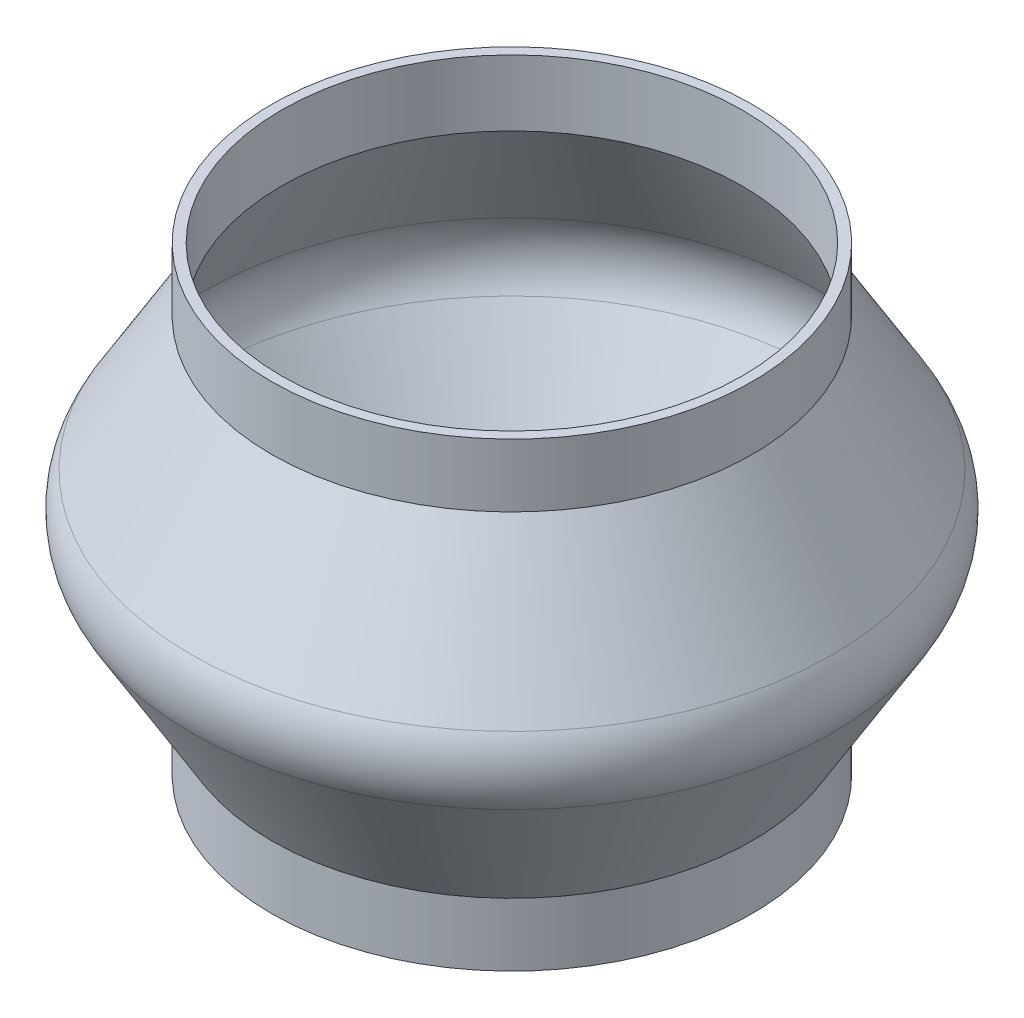
from build123d import *


with BuildPart() as part:
    # Sketch1 → Revolve1 (revolve)
    with BuildSketch(Plane.XY, mode=Mode.PRIVATE) as revolve1_sk:
        with BuildLine():
            Line((-35, 35), (-35, 25))
            Line((-35, 25), (-46.913025467, 5.144957554))
            ThreePointArc((-46.913025467, 5.144957554), (-48.33809621, 0), (-46.913025467, -5.144957554))
            Line((-46.913025467, -5.144957554), (-35, -25))
            Line((-35, -25), (-35, -35))
            Line((-35, -35), (-36.5, -35))
            Line((-36.5, -35), (-36.5, -25.415475947))
            Line((-36.5, -25.415475947), (-48.662311036, -5.144957554))
            ThreePointArc((-48.662311036, -5.144957554), (-50.087381779, 0), (-48.662311036, 5.144957554))
            Line((-48.662311036, 5.144957554), (-36.5, 25.415475947))
            Line((-36.5, 25.415475947), (-36.5, 35))
            Line((-36.5, 35), (-35, 35))
        make_face()
    revolve(revolve1_sk.sketch.rotate(Axis((0, 85.826086957, 0), (0, -1, 0)), 270), axis=Axis((0, 85.826086957, 0), (0, -1, 0)))


solid = part.part
